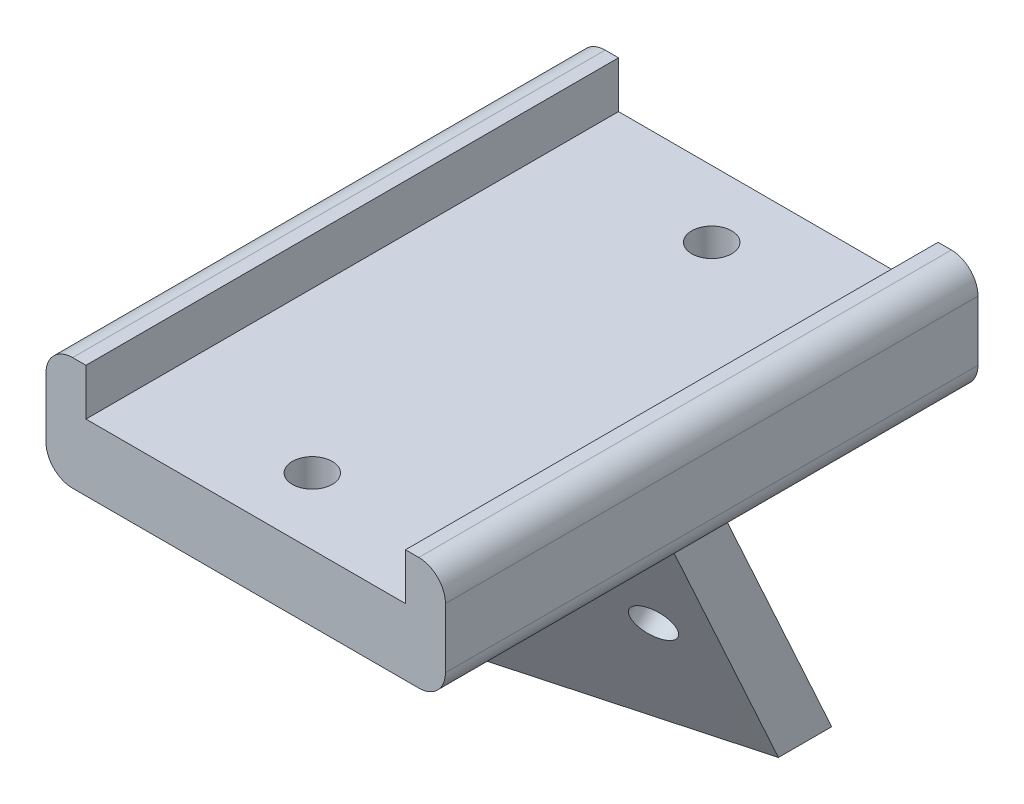
from build123d import *

# Parameters (mm, degrees)
SKETCH1_W                      = 22
SKETCH1_H                      = 40
SKETCH1_R                      = 1.5
BOSS_EXTRUDE1_DEPTH            = 5
BOSS_EXTRUDE3_DEPTH            = 40
FILLET1_R                      = 2
CUT_EXTRUDE1_REACH             = 34.746
SKETCH9_R                      = 1.5
CUT_EXTRUDE1_DIRECTION_2_REACH = 34.746


with BuildPart() as part:
    # Sketch1 → Boss-Extrude1 (new body)
    with BuildSketch(Plane(origin=(0, 0, 0), x_dir=(1, 0, 0), z_dir=(0, 1, 0))):
        Rectangle(SKETCH1_W, SKETCH1_H)
        with Locations(Location((0, 15, 0), (0, 0, 270))):
            Circle(SKETCH1_R, mode=Mode.SUBTRACT)
        with Locations(Location((0, -15, 0), (0, 0, 270))):
            Circle(SKETCH1_R, mode=Mode.SUBTRACT)
    extrude(amount=BOSS_EXTRUDE1_DEPTH)

    # Sketch4 → Boss-Extrude3 (add)
    with BuildSketch(Plane(origin=(0, 0, -20), x_dir=(-1, 0, 0), z_dir=(0, 0, -1))):
        Polygon((-11, 5), (-12, 5), (-12, 8.5), (-15, 8.5), (-15, 0), (-11, 0), align=None)
        Polygon((11, 0), (11, 5), (12, 5), (12, 8.5), (15, 8.5), (15, 0), align=None)
    extrude(amount=-BOSS_EXTRUDE3_DEPTH)

    # Fillet1
    fillet1_edges = [part.edges().sort_by_distance(p)[0] for p in [
        (15, 0, 0),
        (15, 8.5, 0),
        (-15, 0, 0),
        (-15, 8.5, 0),
    ]]
    fillet(fillet1_edges, radius=FILLET1_R)

    # Sketch6 → Loft1 section 0
    with BuildSketch(Plane(origin=(0, -20, 0), x_dir=(1, 0, 0), z_dir=(0, 1, 0))):
        with BuildLine():
            Line((11.018014761, 12.99270703), (-11, 7))
            Line((-11, 7), (-11, 3))
            Line((-11, 3), (11.018014761, 8.99270703))
            Line((11.018014761, 8.99270703), (11.018014761, 12.99270703))
        make_face()
    # Sketch2 → Loft1 section 1
    with BuildSketch(Plane.XZ):
        with BuildLine():
            Line((-11, 6), (11, 0.105117767))
            Line((11, 0.105117767), (11, -3.894882233))
            Line((11, -3.894882233), (-11, 2))
            Line((-11, 2), (-11, 6))
        make_face()
    loft()

    # Sketch9 → Cut-Extrude1 (cut, up to next)
    with BuildSketch(Plane(origin=(-0.191463171, 0.319826035, -0.703461542), x_dir=(-0.9706501889890885, -0.09953611163264846, 0.21893097792797594), z_dir=(-0.24049576007790016, 0.4017315961669107, -0.8836138942013866)), mode=Mode.PRIVATE) as cut_extrude1_sk1:
        with Locations(Location((-6.537902116, -11.132046288, 0), (0, 0, 90))):
            Circle(SKETCH9_R)
    cut_extrude1_tool1 = extrude(cut_extrude1_sk1.sketch, amount=-CUT_EXTRUDE1_REACH, mode=Mode.PRIVATE) & part.part
    # Sketch9 → Cut-Extrude1 (cut, up to next)
    with BuildSketch(Plane(origin=(-0.191463171, 0.319826035, -0.703461542), x_dir=(-0.9706501889890885, -0.09953611163264846, 0.21893097792797594), z_dir=(-0.24049576007790016, 0.4017315961669107, -0.8836138942013866)), mode=Mode.PRIVATE) as cut_extrude1_sk2:
        with Locations(Location((6.124840152, -9.767757873, 0), (0, 0, 90))):
            Circle(SKETCH9_R)
    cut_extrude1_tool2 = extrude(cut_extrude1_sk2.sketch, amount=-CUT_EXTRUDE1_REACH, mode=Mode.PRIVATE) & part.part
    add(cut_extrude1_tool1.solids().sort_by_distance((6.154553, -9.163274, -6.74213))[0], mode=Mode.SUBTRACT)
    add(cut_extrude1_tool2.solids().sort_by_distance((-6.13654, -9.181719, -3.405213))[0], mode=Mode.SUBTRACT)

    # Sketch9 → Cut-Extrude1 direction 2 (cut, up to next)
    with BuildSketch(Plane(origin=(-0.191463171, 0.319826035, -0.703461542), x_dir=(-0.9706501889890885, -0.09953611163264846, 0.21893097792797594), z_dir=(-0.24049576007790016, 0.4017315961669107, -0.8836138942013866)), mode=Mode.PRIVATE) as cut_extrude1_direction_2_sk1:
        with Locations(Location((-6.537902116, -11.132046288, 0), (0, 0, 90))):
            Circle(SKETCH9_R)
    cut_extrude1_direction_2_tool1 = extrude(cut_extrude1_direction_2_sk1.sketch, amount=CUT_EXTRUDE1_DIRECTION_2_REACH, mode=Mode.PRIVATE) & part.part
    # Sketch9 → Cut-Extrude1 direction 2 (cut, up to next)
    with BuildSketch(Plane(origin=(-0.191463171, 0.319826035, -0.703461542), x_dir=(-0.9706501889890885, -0.09953611163264846, 0.21893097792797594), z_dir=(-0.24049576007790016, 0.4017315961669107, -0.8836138942013866)), mode=Mode.PRIVATE) as cut_extrude1_direction_2_sk2:
        with Locations(Location((6.124840152, -9.767757873, 0), (0, 0, 90))):
            Circle(SKETCH9_R)
    cut_extrude1_direction_2_tool2 = extrude(cut_extrude1_direction_2_sk2.sketch, amount=CUT_EXTRUDE1_DIRECTION_2_REACH, mode=Mode.PRIVATE) & part.part
    add(cut_extrude1_direction_2_tool1.solids().sort_by_distance((6.154553, -9.163274, -6.74213))[0], mode=Mode.SUBTRACT)
    add(cut_extrude1_direction_2_tool2.solids().sort_by_distance((-6.13654, -9.181719, -3.405213))[0], mode=Mode.SUBTRACT)


solid = part.part
